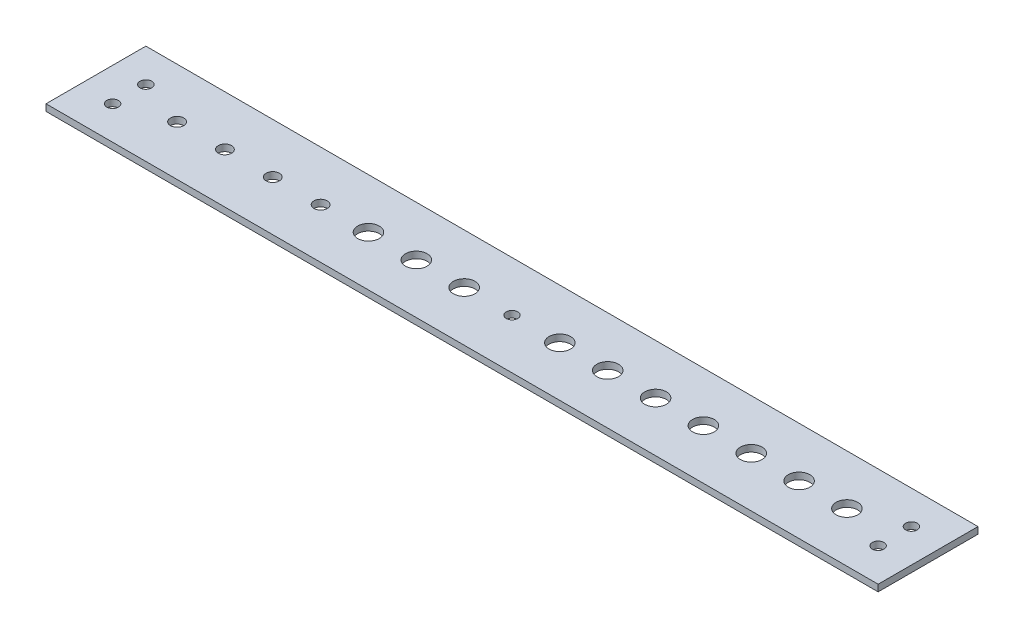
from build123d import *

# Parameters (mm, degrees)
SKETCH1_W           = 250
SKETCH1_H           = 30
SKETCH1_R           = 1.75
SKETCH1_R_2         = 2
SKETCH1_R_3         = 3.25
BOSS_EXTRUDE1_DEPTH = 2


with BuildPart() as part:
    # Sketch1 → Boss-Extrude1 (new body)
    with BuildSketch(Plane(origin=(0, 0, 0), x_dir=(1, 0, 0), z_dir=(0, 1, 0))):
        Rectangle(SKETCH1_W, SKETCH1_H)
        with Locations(Location((-115, 5, 0), (0, 0, 270))):
            Circle(SKETCH1_R, mode=Mode.SUBTRACT)
        with Locations(Location((-115, -5, 0), (0, 0, 270))):
            Circle(SKETCH1_R, mode=Mode.SUBTRACT)
        with Locations(Location((0, 0, 0), (0, 0, 270))):
            Circle(SKETCH1_R, mode=Mode.SUBTRACT)
        with Locations(Location((115, 5, 0), (0, 0, 270))):
            Circle(SKETCH1_R, mode=Mode.SUBTRACT)
        with Locations(Location((115, -5, 0), (0, 0, 270))):
            Circle(SKETCH1_R, mode=Mode.SUBTRACT)
        with Locations(Location((-100.625, 0, 0), (0, 0, 270))):
            Circle(SKETCH1_R_2, mode=Mode.SUBTRACT)
        with Locations(Location((-71.875, 0, 0), (0, 0, 270))):
            Circle(SKETCH1_R_2, mode=Mode.SUBTRACT)
        with Locations(Location((-57.5, 0, 0), (0, 0, 270))):
            Circle(SKETCH1_R_2, mode=Mode.SUBTRACT)
        with Locations(Location((14.375, 0, 0), (0, 0, 270))):
            Circle(SKETCH1_R_3, mode=Mode.SUBTRACT)
        with Locations(Location((43.125, 0, 0), (0, 0, 270))):
            Circle(SKETCH1_R_3, mode=Mode.SUBTRACT)
        with Locations(Location((57.5, 0, 0), (0, 0, 270))):
            Circle(SKETCH1_R_3, mode=Mode.SUBTRACT)
        with Locations(Location((71.875, 0, 0), (0, 0, 270))):
            Circle(SKETCH1_R_3, mode=Mode.SUBTRACT)
        with Locations(Location((86.25, 0, 0), (0, 0, 270))):
            Circle(SKETCH1_R_3, mode=Mode.SUBTRACT)
        with Locations(Location((100.625, 0, 0), (0, 0, 270))):
            Circle(SKETCH1_R_3, mode=Mode.SUBTRACT)
        with Locations(Location((-43.125, 0, 0), (0, 0, 270))):
            Circle(SKETCH1_R_3, mode=Mode.SUBTRACT)
        with Locations(Location((-86.25, 0, 0), (0, 0, 270))):
            Circle(SKETCH1_R_2, mode=Mode.SUBTRACT)
        with Locations(Location((-28.75, 0, 0), (0, 0, 270))):
            Circle(SKETCH1_R_3, mode=Mode.SUBTRACT)
        with Locations(Location((-14.375, 0, 0), (0, 0, 270))):
            Circle(SKETCH1_R_3, mode=Mode.SUBTRACT)
        with Locations(Location((28.75, 0, 0), (0, 0, 270))):
            Circle(SKETCH1_R_3, mode=Mode.SUBTRACT)
    extrude(amount=BOSS_EXTRUDE1_DEPTH)


solid = part.part
